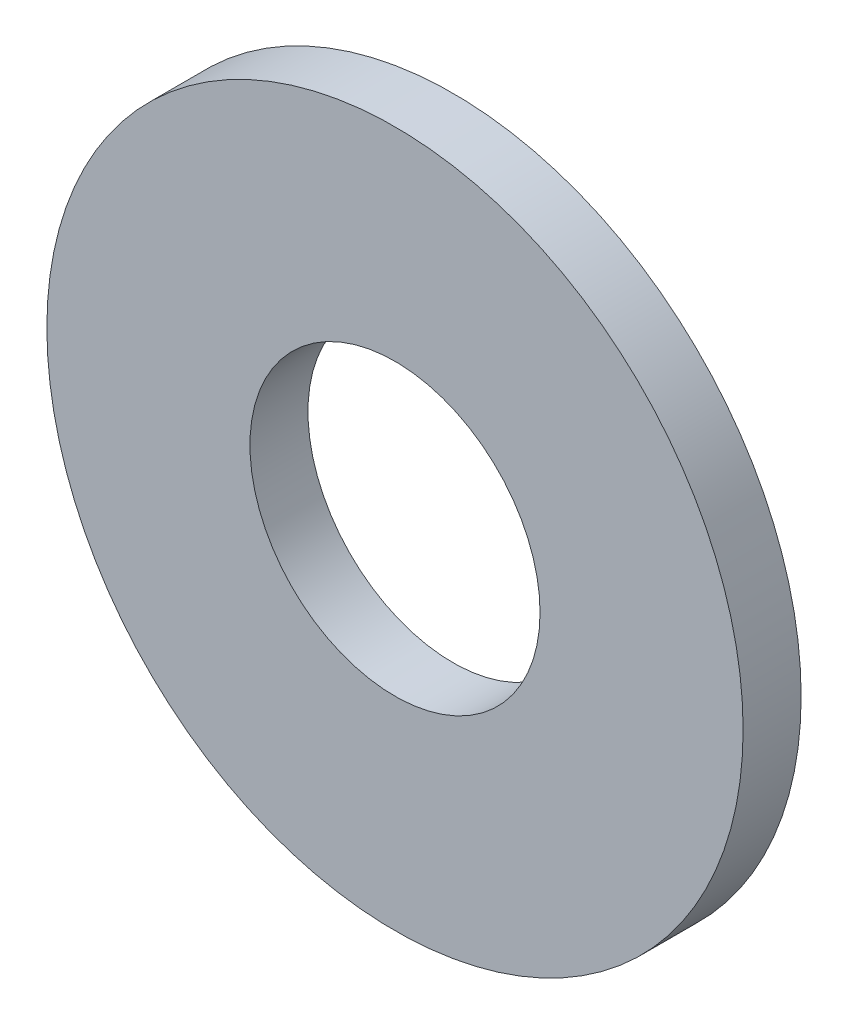
from build123d import *

# Parameters (mm, degrees)
SKETCH1_R           = 9.525
SKETCH1_R_2         = 3.96875
BOSS_EXTRUDE1_DEPTH = 0.79375


with BuildPart() as part:
    # Sketch1 → Boss-Extrude1 (new, symmetric)
    with BuildSketch(Plane.XY):
        Circle(SKETCH1_R)
        Circle(SKETCH1_R_2, mode=Mode.SUBTRACT)
    extrude(amount=BOSS_EXTRUDE1_DEPTH, both=True)


solid = part.part
